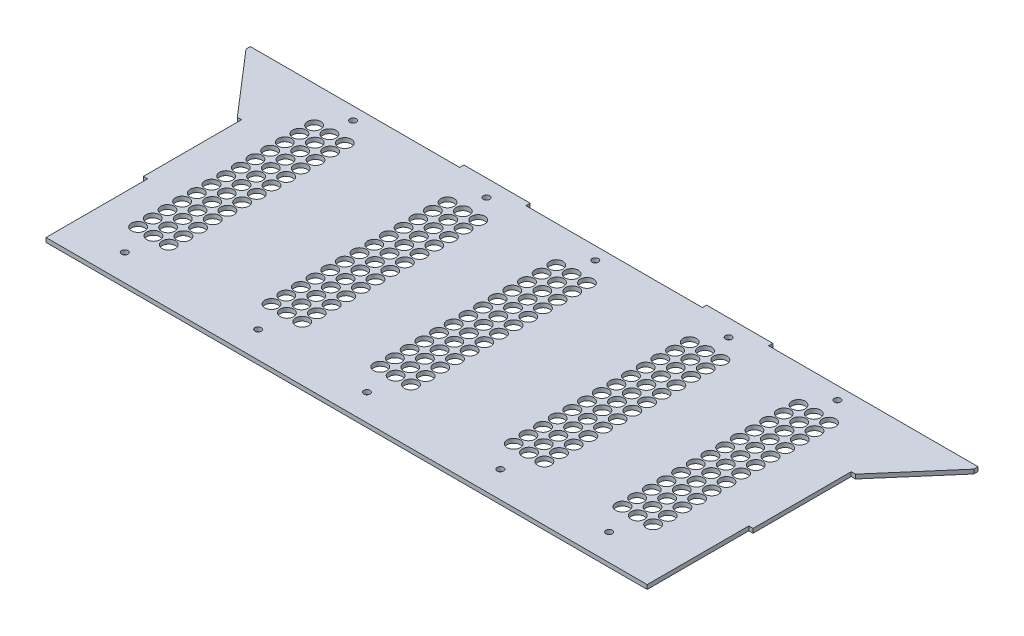
from build123d import *

# Parameters (mm, degrees)
SKETCH1_W                  = 457.2230066
SKETCH1_H                  = 3.175
BOSS_EXTRUDE1_DEPTH        = 200.6419914
BOSS_EXTRUDE3_DEPTH        = 3.175
SKETCH5_W                  = 3.175
SKETCH5_H                  = 76.2
CUT_EXTRUDE2_DEPTH         = 3.175
SKETCH3_W                  = 49.658811606
SKETCH3_H                  = 3.175
BOSS_EXTRUDE4_DEPTH        = 3.18
M4_CLEARANCE_HOLE1_D       = 4.8
LPATTERN5_COUNT            = 3
LPATTERN5_PITCH            = 181.61399999
M4_CLEARANCE_HOLE2_D       = 4.8
LPATTERN6_COUNT            = 2
LPATTERN6_PITCH            = 181.61399999
SKETCH10_R                 = 5
CUT_EXTRUDE3_DEPTH         = 339.72456808
LPATTERN1_COUNT            = 13
LPATTERN1_PITCH            = 11
LPATTERN2_COUNT            = 3
LPATTERN2_PITCH            = 181.61399999
LPATTERN2_COPY_1_SKETCH_R  = 5
LPATTERN2_COPY_1_DEPTH     = 339.72456808
LPATTERN2_COPY_2_SKETCH_R  = 5
LPATTERN2_COPY_2_DEPTH     = 339.72456808
LPATTERN2_COPY_3_SKETCH_R  = 5
LPATTERN2_COPY_3_DEPTH     = 339.72456808
LPATTERN2_COPY_4_SKETCH_R  = 5
LPATTERN2_COPY_4_DEPTH     = 339.72456808
LPATTERN2_COPY_5_SKETCH_R  = 5
LPATTERN2_COPY_5_DEPTH     = 339.72456808
LPATTERN2_COPY_6_SKETCH_R  = 5
LPATTERN2_COPY_6_DEPTH     = 339.72456808
LPATTERN2_COPY_7_SKETCH_R  = 5
LPATTERN2_COPY_7_DEPTH     = 339.72456808
LPATTERN2_COPY_8_SKETCH_R  = 5
LPATTERN2_COPY_8_DEPTH     = 339.72456808
LPATTERN2_COPY_9_SKETCH_R  = 5
LPATTERN2_COPY_9_DEPTH     = 339.72456808
LPATTERN2_COPY_10_SKETCH_R = 5
LPATTERN2_COPY_10_DEPTH    = 339.72456808
LPATTERN2_COPY_11_SKETCH_R = 5
LPATTERN2_COPY_11_DEPTH    = 339.72456808
LPATTERN2_COPY_12_SKETCH_R = 5
LPATTERN2_COPY_12_DEPTH    = 339.72456808
LPATTERN2_COPY_13_SKETCH_R = 5
LPATTERN2_COPY_13_DEPTH    = 339.72456808
LPATTERN2_COPY_14_SKETCH_R = 5
LPATTERN2_COPY_14_DEPTH    = 339.72456808
LPATTERN2_COPY_15_SKETCH_R = 5
LPATTERN2_COPY_15_DEPTH    = 339.72456808
LPATTERN2_COPY_16_SKETCH_R = 5
LPATTERN2_COPY_16_DEPTH    = 339.72456808
LPATTERN2_COPY_17_SKETCH_R = 5
LPATTERN2_COPY_17_DEPTH    = 339.72456808
LPATTERN2_COPY_18_SKETCH_R = 5
LPATTERN2_COPY_18_DEPTH    = 339.72456808
LPATTERN2_COPY_19_SKETCH_R = 5
LPATTERN2_COPY_19_DEPTH    = 339.72456808
LPATTERN2_COPY_20_SKETCH_R = 5
LPATTERN2_COPY_20_DEPTH    = 339.72456808
LPATTERN2_COPY_21_SKETCH_R = 5
LPATTERN2_COPY_21_DEPTH    = 339.72456808
LPATTERN2_COPY_22_SKETCH_R = 5
LPATTERN2_COPY_22_DEPTH    = 339.72456808
LPATTERN2_COPY_23_SKETCH_R = 5
LPATTERN2_COPY_23_DEPTH    = 339.72456808
LPATTERN2_COPY_24_SKETCH_R = 5
LPATTERN2_COPY_24_DEPTH    = 339.72456808
SKETCH11_R                 = 5
CUT_EXTRUDE4_DEPTH         = 339.72456808
LPATTERN3_COUNT            = 13
LPATTERN3_PITCH            = 11
LPATTERN4_COUNT            = 2
LPATTERN4_PITCH            = 181.61399999
LPATTERN4_COPY_1_SKETCH_R  = 5
LPATTERN4_COPY_1_DEPTH     = 339.72456808
LPATTERN4_COPY_2_SKETCH_R  = 5
LPATTERN4_COPY_2_DEPTH     = 339.72456808
LPATTERN4_COPY_3_SKETCH_R  = 5
LPATTERN4_COPY_3_DEPTH     = 339.72456808
LPATTERN4_COPY_4_SKETCH_R  = 5
LPATTERN4_COPY_4_DEPTH     = 339.72456808
LPATTERN4_COPY_5_SKETCH_R  = 5
LPATTERN4_COPY_5_DEPTH     = 339.72456808
LPATTERN4_COPY_6_SKETCH_R  = 5
LPATTERN4_COPY_6_DEPTH     = 339.72456808
LPATTERN4_COPY_7_SKETCH_R  = 5
LPATTERN4_COPY_7_DEPTH     = 339.72456808
LPATTERN4_COPY_8_SKETCH_R  = 5
LPATTERN4_COPY_8_DEPTH     = 339.72456808
LPATTERN4_COPY_9_SKETCH_R  = 5
LPATTERN4_COPY_9_DEPTH     = 339.72456808
LPATTERN4_COPY_10_SKETCH_R = 5
LPATTERN4_COPY_10_DEPTH    = 339.72456808
LPATTERN4_COPY_11_SKETCH_R = 5
LPATTERN4_COPY_11_DEPTH    = 339.72456808
LPATTERN4_COPY_12_SKETCH_R = 5
LPATTERN4_COPY_12_DEPTH    = 339.72456808


with BuildPart() as part:
    # Sketch1 → Boss-Extrude1 (new body)
    with BuildSketch(Plane.XY):
        Rectangle(SKETCH1_W, SKETCH1_H)
    extrude(amount=BOSS_EXTRUDE1_DEPTH)

    # Sketch4 → Boss-Extrude3 (add)
    with BuildSketch(Plane.XZ.offset(1.5875)):
        Polygon((-228.6115033, 0), (-272.8865033, 0), (-272.8865033, 3.175), (-231.7865033, 50.8), (-228.6115033, 50.8), align=None)
    boss_extrude3 = extrude(amount=-BOSS_EXTRUDE3_DEPTH)

    # Mirror1: Boss-Extrude3 across plane
    add(boss_extrude3.mirror(Plane(origin=(0, 0, 0), x_dir=(0, 0, 1), z_dir=(1, 0, 0))))

    # Sketch5 → Cut-Extrude2 (cut)
    with BuildSketch(Plane.XZ.offset(1.5875)):
        with Locations((-227.0240033, 162.5419914)):
            Rectangle(SKETCH5_W, SKETCH5_H)
    cut_extrude2 = extrude(amount=-CUT_EXTRUDE2_DEPTH, mode=Mode.SUBTRACT)

    # Mirror2: Cut-Extrude2 across plane
    add(cut_extrude2.mirror(Plane(origin=(0, 0, 0), x_dir=(0, 0, 1), z_dir=(1, 0, 0))), mode=Mode.SUBTRACT)

    # Sketch3 → Boss-Extrude4 (add)
    with BuildSketch(Plane(origin=(0, 0, 0), x_dir=(-1, 0, 0), z_dir=(0, 0, -1))):
        with Locations((-91.020094169, 0)):
            Rectangle(SKETCH3_W, SKETCH3_H)
        with Locations((91.020094169, 0)):
            Rectangle(SKETCH3_W, SKETCH3_H)
    extrude(amount=BOSS_EXTRUDE4_DEPTH)

    # M4 Clearance Hole1 (through all)
    with Locations(Plane.XZ.offset(1.5875)):
        with Locations((-186.235499988, 9.525), (-186.235499988, 180.775)):
            m4_clearance_hole1 = Hole(M4_CLEARANCE_HOLE1_D / 2)

    # LPattern5: M4 Clearance Hole1 ×3
    with Locations(*[(i * LPATTERN5_PITCH, 0, 0) for i in range(1, LPATTERN5_COUNT)]):
        add(m4_clearance_hole1, mode=Mode.SUBTRACT)

    # M4 Clearance Hole2 (through all)
    with Locations(Plane.XZ.offset(1.5875)):
        with Locations((-86.190499988, 9.525), (-86.190499988, 180.775)):
            m4_clearance_hole2 = Hole(M4_CLEARANCE_HOLE2_D / 2)

    # LPattern6: M4 Clearance Hole2 ×2
    with Locations(*[(i * LPATTERN6_PITCH, 0, 0) for i in range(1, LPATTERN6_COUNT)]):
        add(m4_clearance_hole2, mode=Mode.SUBTRACT)

    # Sketch10 → Cut-Extrude3 (cut, through all)
    with BuildSketch(Plane.XZ.offset(1.5875)):
        with Locations(Location((-197.735499988, 159.256662939, 0), (0, 0, 270))):
            Circle(SKETCH10_R)
        with Locations(Location((-186.235499988, 159.256662939, 0), (0, 0, 270))):
            Circle(SKETCH10_R)
        with Locations(Location((-174.735499988, 159.256662939, 0), (0, 0, 270))):
            Circle(SKETCH10_R)
    cut_extrude3 = extrude(amount=-CUT_EXTRUDE3_DEPTH, mode=Mode.SUBTRACT)

    # LPattern1: Cut-Extrude3 ×13
    with Locations(*[(0, 0, -i * LPATTERN1_PITCH) for i in range(1, LPATTERN1_COUNT)]):
        add(cut_extrude3, mode=Mode.SUBTRACT)

    # LPattern2: Cut-Extrude3 ×3
    with Locations(*[(i * LPATTERN2_PITCH, 0, 0) for i in range(1, LPATTERN2_COUNT)]):
        add(cut_extrude3, mode=Mode.SUBTRACT)

    # LPattern2 copy 1 sketch → LPattern2 copy 1 (cut, through all)
    with BuildSketch(Plane(origin=(181.61399999, -1.5875, -11), x_dir=(1, 0, 0), z_dir=(0, -1, 0))):
        with Locations(Location((-197.735499988, 159.256662939, 0), (0, 0, 270))):
            Circle(LPATTERN2_COPY_1_SKETCH_R)
        with Locations(Location((-186.235499988, 159.256662939, 0), (0, 0, 270))):
            Circle(LPATTERN2_COPY_1_SKETCH_R)
        with Locations(Location((-174.735499988, 159.256662939, 0), (0, 0, 270))):
            Circle(LPATTERN2_COPY_1_SKETCH_R)
    extrude(amount=-LPATTERN2_COPY_1_DEPTH, mode=Mode.SUBTRACT)

    # LPattern2 copy 2 sketch → LPattern2 copy 2 (cut, through all)
    with BuildSketch(Plane(origin=(363.22799998, -1.5875, -11), x_dir=(1, 0, 0), z_dir=(0, -1, 0))):
        with Locations(Location((-197.735499988, 159.256662939, 0), (0, 0, 270))):
            Circle(LPATTERN2_COPY_2_SKETCH_R)
        with Locations(Location((-186.235499988, 159.256662939, 0), (0, 0, 270))):
            Circle(LPATTERN2_COPY_2_SKETCH_R)
        with Locations(Location((-174.735499988, 159.256662939, 0), (0, 0, 270))):
            Circle(LPATTERN2_COPY_2_SKETCH_R)
    extrude(amount=-LPATTERN2_COPY_2_DEPTH, mode=Mode.SUBTRACT)

    # LPattern2 copy 3 sketch → LPattern2 copy 3 (cut, through all)
    with BuildSketch(Plane(origin=(181.61399999, -1.5875, -22), x_dir=(1, 0, 0), z_dir=(0, -1, 0))):
        with Locations(Location((-197.735499988, 159.256662939, 0), (0, 0, 270))):
            Circle(LPATTERN2_COPY_3_SKETCH_R)
        with Locations(Location((-186.235499988, 159.256662939, 0), (0, 0, 270))):
            Circle(LPATTERN2_COPY_3_SKETCH_R)
        with Locations(Location((-174.735499988, 159.256662939, 0), (0, 0, 270))):
            Circle(LPATTERN2_COPY_3_SKETCH_R)
    extrude(amount=-LPATTERN2_COPY_3_DEPTH, mode=Mode.SUBTRACT)

    # LPattern2 copy 4 sketch → LPattern2 copy 4 (cut, through all)
    with BuildSketch(Plane(origin=(363.22799998, -1.5875, -22), x_dir=(1, 0, 0), z_dir=(0, -1, 0))):
        with Locations(Location((-197.735499988, 159.256662939, 0), (0, 0, 270))):
            Circle(LPATTERN2_COPY_4_SKETCH_R)
        with Locations(Location((-186.235499988, 159.256662939, 0), (0, 0, 270))):
            Circle(LPATTERN2_COPY_4_SKETCH_R)
        with Locations(Location((-174.735499988, 159.256662939, 0), (0, 0, 270))):
            Circle(LPATTERN2_COPY_4_SKETCH_R)
    extrude(amount=-LPATTERN2_COPY_4_DEPTH, mode=Mode.SUBTRACT)

    # LPattern2 copy 5 sketch → LPattern2 copy 5 (cut, through all)
    with BuildSketch(Plane(origin=(181.61399999, -1.5875, -33), x_dir=(1, 0, 0), z_dir=(0, -1, 0))):
        with Locations(Location((-197.735499988, 159.256662939, 0), (0, 0, 270))):
            Circle(LPATTERN2_COPY_5_SKETCH_R)
        with Locations(Location((-186.235499988, 159.256662939, 0), (0, 0, 270))):
            Circle(LPATTERN2_COPY_5_SKETCH_R)
        with Locations(Location((-174.735499988, 159.256662939, 0), (0, 0, 270))):
            Circle(LPATTERN2_COPY_5_SKETCH_R)
    extrude(amount=-LPATTERN2_COPY_5_DEPTH, mode=Mode.SUBTRACT)

    # LPattern2 copy 6 sketch → LPattern2 copy 6 (cut, through all)
    with BuildSketch(Plane(origin=(363.22799998, -1.5875, -33), x_dir=(1, 0, 0), z_dir=(0, -1, 0))):
        with Locations(Location((-197.735499988, 159.256662939, 0), (0, 0, 270))):
            Circle(LPATTERN2_COPY_6_SKETCH_R)
        with Locations(Location((-186.235499988, 159.256662939, 0), (0, 0, 270))):
            Circle(LPATTERN2_COPY_6_SKETCH_R)
        with Locations(Location((-174.735499988, 159.256662939, 0), (0, 0, 270))):
            Circle(LPATTERN2_COPY_6_SKETCH_R)
    extrude(amount=-LPATTERN2_COPY_6_DEPTH, mode=Mode.SUBTRACT)

    # LPattern2 copy 7 sketch → LPattern2 copy 7 (cut, through all)
    with BuildSketch(Plane(origin=(181.61399999, -1.5875, -44), x_dir=(1, 0, 0), z_dir=(0, -1, 0))):
        with Locations(Location((-197.735499988, 159.256662939, 0), (0, 0, 270))):
            Circle(LPATTERN2_COPY_7_SKETCH_R)
        with Locations(Location((-186.235499988, 159.256662939, 0), (0, 0, 270))):
            Circle(LPATTERN2_COPY_7_SKETCH_R)
        with Locations(Location((-174.735499988, 159.256662939, 0), (0, 0, 270))):
            Circle(LPATTERN2_COPY_7_SKETCH_R)
    extrude(amount=-LPATTERN2_COPY_7_DEPTH, mode=Mode.SUBTRACT)

    # LPattern2 copy 8 sketch → LPattern2 copy 8 (cut, through all)
    with BuildSketch(Plane(origin=(363.22799998, -1.5875, -44), x_dir=(1, 0, 0), z_dir=(0, -1, 0))):
        with Locations(Location((-197.735499988, 159.256662939, 0), (0, 0, 270))):
            Circle(LPATTERN2_COPY_8_SKETCH_R)
        with Locations(Location((-186.235499988, 159.256662939, 0), (0, 0, 270))):
            Circle(LPATTERN2_COPY_8_SKETCH_R)
        with Locations(Location((-174.735499988, 159.256662939, 0), (0, 0, 270))):
            Circle(LPATTERN2_COPY_8_SKETCH_R)
    extrude(amount=-LPATTERN2_COPY_8_DEPTH, mode=Mode.SUBTRACT)

    # LPattern2 copy 9 sketch → LPattern2 copy 9 (cut, through all)
    with BuildSketch(Plane(origin=(181.61399999, -1.5875, -55), x_dir=(1, 0, 0), z_dir=(0, -1, 0))):
        with Locations(Location((-197.735499988, 159.256662939, 0), (0, 0, 270))):
            Circle(LPATTERN2_COPY_9_SKETCH_R)
        with Locations(Location((-186.235499988, 159.256662939, 0), (0, 0, 270))):
            Circle(LPATTERN2_COPY_9_SKETCH_R)
        with Locations(Location((-174.735499988, 159.256662939, 0), (0, 0, 270))):
            Circle(LPATTERN2_COPY_9_SKETCH_R)
    extrude(amount=-LPATTERN2_COPY_9_DEPTH, mode=Mode.SUBTRACT)

    # LPattern2 copy 10 sketch → LPattern2 copy 10 (cut, through all)
    with BuildSketch(Plane(origin=(363.22799998, -1.5875, -55), x_dir=(1, 0, 0), z_dir=(0, -1, 0))):
        with Locations(Location((-197.735499988, 159.256662939, 0), (0, 0, 270))):
            Circle(LPATTERN2_COPY_10_SKETCH_R)
        with Locations(Location((-186.235499988, 159.256662939, 0), (0, 0, 270))):
            Circle(LPATTERN2_COPY_10_SKETCH_R)
        with Locations(Location((-174.735499988, 159.256662939, 0), (0, 0, 270))):
            Circle(LPATTERN2_COPY_10_SKETCH_R)
    extrude(amount=-LPATTERN2_COPY_10_DEPTH, mode=Mode.SUBTRACT)

    # LPattern2 copy 11 sketch → LPattern2 copy 11 (cut, through all)
    with BuildSketch(Plane(origin=(181.61399999, -1.5875, -66), x_dir=(1, 0, 0), z_dir=(0, -1, 0))):
        with Locations(Location((-197.735499988, 159.256662939, 0), (0, 0, 270))):
            Circle(LPATTERN2_COPY_11_SKETCH_R)
        with Locations(Location((-186.235499988, 159.256662939, 0), (0, 0, 270))):
            Circle(LPATTERN2_COPY_11_SKETCH_R)
        with Locations(Location((-174.735499988, 159.256662939, 0), (0, 0, 270))):
            Circle(LPATTERN2_COPY_11_SKETCH_R)
    extrude(amount=-LPATTERN2_COPY_11_DEPTH, mode=Mode.SUBTRACT)

    # LPattern2 copy 12 sketch → LPattern2 copy 12 (cut, through all)
    with BuildSketch(Plane(origin=(363.22799998, -1.5875, -66), x_dir=(1, 0, 0), z_dir=(0, -1, 0))):
        with Locations(Location((-197.735499988, 159.256662939, 0), (0, 0, 270))):
            Circle(LPATTERN2_COPY_12_SKETCH_R)
        with Locations(Location((-186.235499988, 159.256662939, 0), (0, 0, 270))):
            Circle(LPATTERN2_COPY_12_SKETCH_R)
        with Locations(Location((-174.735499988, 159.256662939, 0), (0, 0, 270))):
            Circle(LPATTERN2_COPY_12_SKETCH_R)
    extrude(amount=-LPATTERN2_COPY_12_DEPTH, mode=Mode.SUBTRACT)

    # LPattern2 copy 13 sketch → LPattern2 copy 13 (cut, through all)
    with BuildSketch(Plane(origin=(181.61399999, -1.5875, -77), x_dir=(1, 0, 0), z_dir=(0, -1, 0))):
        with Locations(Location((-197.735499988, 159.256662939, 0), (0, 0, 270))):
            Circle(LPATTERN2_COPY_13_SKETCH_R)
        with Locations(Location((-186.235499988, 159.256662939, 0), (0, 0, 270))):
            Circle(LPATTERN2_COPY_13_SKETCH_R)
        with Locations(Location((-174.735499988, 159.256662939, 0), (0, 0, 270))):
            Circle(LPATTERN2_COPY_13_SKETCH_R)
    extrude(amount=-LPATTERN2_COPY_13_DEPTH, mode=Mode.SUBTRACT)

    # LPattern2 copy 14 sketch → LPattern2 copy 14 (cut, through all)
    with BuildSketch(Plane(origin=(363.22799998, -1.5875, -77), x_dir=(1, 0, 0), z_dir=(0, -1, 0))):
        with Locations(Location((-197.735499988, 159.256662939, 0), (0, 0, 270))):
            Circle(LPATTERN2_COPY_14_SKETCH_R)
        with Locations(Location((-186.235499988, 159.256662939, 0), (0, 0, 270))):
            Circle(LPATTERN2_COPY_14_SKETCH_R)
        with Locations(Location((-174.735499988, 159.256662939, 0), (0, 0, 270))):
            Circle(LPATTERN2_COPY_14_SKETCH_R)
    extrude(amount=-LPATTERN2_COPY_14_DEPTH, mode=Mode.SUBTRACT)

    # LPattern2 copy 15 sketch → LPattern2 copy 15 (cut, through all)
    with BuildSketch(Plane(origin=(181.61399999, -1.5875, -88), x_dir=(1, 0, 0), z_dir=(0, -1, 0))):
        with Locations(Location((-197.735499988, 159.256662939, 0), (0, 0, 270))):
            Circle(LPATTERN2_COPY_15_SKETCH_R)
        with Locations(Location((-186.235499988, 159.256662939, 0), (0, 0, 270))):
            Circle(LPATTERN2_COPY_15_SKETCH_R)
        with Locations(Location((-174.735499988, 159.256662939, 0), (0, 0, 270))):
            Circle(LPATTERN2_COPY_15_SKETCH_R)
    extrude(amount=-LPATTERN2_COPY_15_DEPTH, mode=Mode.SUBTRACT)

    # LPattern2 copy 16 sketch → LPattern2 copy 16 (cut, through all)
    with BuildSketch(Plane(origin=(363.22799998, -1.5875, -88), x_dir=(1, 0, 0), z_dir=(0, -1, 0))):
        with Locations(Location((-197.735499988, 159.256662939, 0), (0, 0, 270))):
            Circle(LPATTERN2_COPY_16_SKETCH_R)
        with Locations(Location((-186.235499988, 159.256662939, 0), (0, 0, 270))):
            Circle(LPATTERN2_COPY_16_SKETCH_R)
        with Locations(Location((-174.735499988, 159.256662939, 0), (0, 0, 270))):
            Circle(LPATTERN2_COPY_16_SKETCH_R)
    extrude(amount=-LPATTERN2_COPY_16_DEPTH, mode=Mode.SUBTRACT)

    # LPattern2 copy 17 sketch → LPattern2 copy 17 (cut, through all)
    with BuildSketch(Plane(origin=(181.61399999, -1.5875, -99), x_dir=(1, 0, 0), z_dir=(0, -1, 0))):
        with Locations(Location((-197.735499988, 159.256662939, 0), (0, 0, 270))):
            Circle(LPATTERN2_COPY_17_SKETCH_R)
        with Locations(Location((-186.235499988, 159.256662939, 0), (0, 0, 270))):
            Circle(LPATTERN2_COPY_17_SKETCH_R)
        with Locations(Location((-174.735499988, 159.256662939, 0), (0, 0, 270))):
            Circle(LPATTERN2_COPY_17_SKETCH_R)
    extrude(amount=-LPATTERN2_COPY_17_DEPTH, mode=Mode.SUBTRACT)

    # LPattern2 copy 18 sketch → LPattern2 copy 18 (cut, through all)
    with BuildSketch(Plane(origin=(363.22799998, -1.5875, -99), x_dir=(1, 0, 0), z_dir=(0, -1, 0))):
        with Locations(Location((-197.735499988, 159.256662939, 0), (0, 0, 270))):
            Circle(LPATTERN2_COPY_18_SKETCH_R)
        with Locations(Location((-186.235499988, 159.256662939, 0), (0, 0, 270))):
            Circle(LPATTERN2_COPY_18_SKETCH_R)
        with Locations(Location((-174.735499988, 159.256662939, 0), (0, 0, 270))):
            Circle(LPATTERN2_COPY_18_SKETCH_R)
    extrude(amount=-LPATTERN2_COPY_18_DEPTH, mode=Mode.SUBTRACT)

    # LPattern2 copy 19 sketch → LPattern2 copy 19 (cut, through all)
    with BuildSketch(Plane(origin=(181.61399999, -1.5875, -110), x_dir=(1, 0, 0), z_dir=(0, -1, 0))):
        with Locations(Location((-197.735499988, 159.256662939, 0), (0, 0, 270))):
            Circle(LPATTERN2_COPY_19_SKETCH_R)
        with Locations(Location((-186.235499988, 159.256662939, 0), (0, 0, 270))):
            Circle(LPATTERN2_COPY_19_SKETCH_R)
        with Locations(Location((-174.735499988, 159.256662939, 0), (0, 0, 270))):
            Circle(LPATTERN2_COPY_19_SKETCH_R)
    extrude(amount=-LPATTERN2_COPY_19_DEPTH, mode=Mode.SUBTRACT)

    # LPattern2 copy 20 sketch → LPattern2 copy 20 (cut, through all)
    with BuildSketch(Plane(origin=(363.22799998, -1.5875, -110), x_dir=(1, 0, 0), z_dir=(0, -1, 0))):
        with Locations(Location((-197.735499988, 159.256662939, 0), (0, 0, 270))):
            Circle(LPATTERN2_COPY_20_SKETCH_R)
        with Locations(Location((-186.235499988, 159.256662939, 0), (0, 0, 270))):
            Circle(LPATTERN2_COPY_20_SKETCH_R)
        with Locations(Location((-174.735499988, 159.256662939, 0), (0, 0, 270))):
            Circle(LPATTERN2_COPY_20_SKETCH_R)
    extrude(amount=-LPATTERN2_COPY_20_DEPTH, mode=Mode.SUBTRACT)

    # LPattern2 copy 21 sketch → LPattern2 copy 21 (cut, through all)
    with BuildSketch(Plane(origin=(181.61399999, -1.5875, -121), x_dir=(1, 0, 0), z_dir=(0, -1, 0))):
        with Locations(Location((-197.735499988, 159.256662939, 0), (0, 0, 270))):
            Circle(LPATTERN2_COPY_21_SKETCH_R)
        with Locations(Location((-186.235499988, 159.256662939, 0), (0, 0, 270))):
            Circle(LPATTERN2_COPY_21_SKETCH_R)
        with Locations(Location((-174.735499988, 159.256662939, 0), (0, 0, 270))):
            Circle(LPATTERN2_COPY_21_SKETCH_R)
    extrude(amount=-LPATTERN2_COPY_21_DEPTH, mode=Mode.SUBTRACT)

    # LPattern2 copy 22 sketch → LPattern2 copy 22 (cut, through all)
    with BuildSketch(Plane(origin=(363.22799998, -1.5875, -121), x_dir=(1, 0, 0), z_dir=(0, -1, 0))):
        with Locations(Location((-197.735499988, 159.256662939, 0), (0, 0, 270))):
            Circle(LPATTERN2_COPY_22_SKETCH_R)
        with Locations(Location((-186.235499988, 159.256662939, 0), (0, 0, 270))):
            Circle(LPATTERN2_COPY_22_SKETCH_R)
        with Locations(Location((-174.735499988, 159.256662939, 0), (0, 0, 270))):
            Circle(LPATTERN2_COPY_22_SKETCH_R)
    extrude(amount=-LPATTERN2_COPY_22_DEPTH, mode=Mode.SUBTRACT)

    # LPattern2 copy 23 sketch → LPattern2 copy 23 (cut, through all)
    with BuildSketch(Plane(origin=(181.61399999, -1.5875, -132), x_dir=(1, 0, 0), z_dir=(0, -1, 0))):
        with Locations(Location((-197.735499988, 159.256662939, 0), (0, 0, 270))):
            Circle(LPATTERN2_COPY_23_SKETCH_R)
        with Locations(Location((-186.235499988, 159.256662939, 0), (0, 0, 270))):
            Circle(LPATTERN2_COPY_23_SKETCH_R)
        with Locations(Location((-174.735499988, 159.256662939, 0), (0, 0, 270))):
            Circle(LPATTERN2_COPY_23_SKETCH_R)
    extrude(amount=-LPATTERN2_COPY_23_DEPTH, mode=Mode.SUBTRACT)

    # LPattern2 copy 24 sketch → LPattern2 copy 24 (cut, through all)
    with BuildSketch(Plane(origin=(363.22799998, -1.5875, -132), x_dir=(1, 0, 0), z_dir=(0, -1, 0))):
        with Locations(Location((-197.735499988, 159.256662939, 0), (0, 0, 270))):
            Circle(LPATTERN2_COPY_24_SKETCH_R)
        with Locations(Location((-186.235499988, 159.256662939, 0), (0, 0, 270))):
            Circle(LPATTERN2_COPY_24_SKETCH_R)
        with Locations(Location((-174.735499988, 159.256662939, 0), (0, 0, 270))):
            Circle(LPATTERN2_COPY_24_SKETCH_R)
    extrude(amount=-LPATTERN2_COPY_24_DEPTH, mode=Mode.SUBTRACT)

    # Sketch11 → Cut-Extrude4 (cut, through all)
    with BuildSketch(Plane.XZ.offset(1.5875)):
        with Locations(Location((-97.690499988, 159.256662939, 0), (0, 0, 270))):
            Circle(SKETCH11_R)
        with Locations(Location((-86.190499988, 159.256662939, 0), (0, 0, 270))):
            Circle(SKETCH11_R)
        with Locations(Location((-74.690499988, 159.256662939, 0), (0, 0, 270))):
            Circle(SKETCH11_R)
    cut_extrude4 = extrude(amount=-CUT_EXTRUDE4_DEPTH, mode=Mode.SUBTRACT)

    # LPattern3: Cut-Extrude4 ×13
    with Locations(*[(0, 0, -i * LPATTERN3_PITCH) for i in range(1, LPATTERN3_COUNT)]):
        add(cut_extrude4, mode=Mode.SUBTRACT)

    # LPattern4: Cut-Extrude4 ×2
    with Locations(*[(i * LPATTERN4_PITCH, 0, 0) for i in range(1, LPATTERN4_COUNT)]):
        add(cut_extrude4, mode=Mode.SUBTRACT)

    # LPattern4 copy 1 sketch → LPattern4 copy 1 (cut, through all)
    with BuildSketch(Plane(origin=(181.61399999, -1.5875, -11), x_dir=(1, 0, 0), z_dir=(0, -1, 0))):
        with Locations(Location((-97.690499988, 159.256662939, 0), (0, 0, 270))):
            Circle(LPATTERN4_COPY_1_SKETCH_R)
        with Locations(Location((-86.190499988, 159.256662939, 0), (0, 0, 270))):
            Circle(LPATTERN4_COPY_1_SKETCH_R)
        with Locations(Location((-74.690499988, 159.256662939, 0), (0, 0, 270))):
            Circle(LPATTERN4_COPY_1_SKETCH_R)
    extrude(amount=-LPATTERN4_COPY_1_DEPTH, mode=Mode.SUBTRACT)

    # LPattern4 copy 2 sketch → LPattern4 copy 2 (cut, through all)
    with BuildSketch(Plane(origin=(181.61399999, -1.5875, -22), x_dir=(1, 0, 0), z_dir=(0, -1, 0))):
        with Locations(Location((-97.690499988, 159.256662939, 0), (0, 0, 270))):
            Circle(LPATTERN4_COPY_2_SKETCH_R)
        with Locations(Location((-86.190499988, 159.256662939, 0), (0, 0, 270))):
            Circle(LPATTERN4_COPY_2_SKETCH_R)
        with Locations(Location((-74.690499988, 159.256662939, 0), (0, 0, 270))):
            Circle(LPATTERN4_COPY_2_SKETCH_R)
    extrude(amount=-LPATTERN4_COPY_2_DEPTH, mode=Mode.SUBTRACT)

    # LPattern4 copy 3 sketch → LPattern4 copy 3 (cut, through all)
    with BuildSketch(Plane(origin=(181.61399999, -1.5875, -33), x_dir=(1, 0, 0), z_dir=(0, -1, 0))):
        with Locations(Location((-97.690499988, 159.256662939, 0), (0, 0, 270))):
            Circle(LPATTERN4_COPY_3_SKETCH_R)
        with Locations(Location((-86.190499988, 159.256662939, 0), (0, 0, 270))):
            Circle(LPATTERN4_COPY_3_SKETCH_R)
        with Locations(Location((-74.690499988, 159.256662939, 0), (0, 0, 270))):
            Circle(LPATTERN4_COPY_3_SKETCH_R)
    extrude(amount=-LPATTERN4_COPY_3_DEPTH, mode=Mode.SUBTRACT)

    # LPattern4 copy 4 sketch → LPattern4 copy 4 (cut, through all)
    with BuildSketch(Plane(origin=(181.61399999, -1.5875, -44), x_dir=(1, 0, 0), z_dir=(0, -1, 0))):
        with Locations(Location((-97.690499988, 159.256662939, 0), (0, 0, 270))):
            Circle(LPATTERN4_COPY_4_SKETCH_R)
        with Locations(Location((-86.190499988, 159.256662939, 0), (0, 0, 270))):
            Circle(LPATTERN4_COPY_4_SKETCH_R)
        with Locations(Location((-74.690499988, 159.256662939, 0), (0, 0, 270))):
            Circle(LPATTERN4_COPY_4_SKETCH_R)
    extrude(amount=-LPATTERN4_COPY_4_DEPTH, mode=Mode.SUBTRACT)

    # LPattern4 copy 5 sketch → LPattern4 copy 5 (cut, through all)
    with BuildSketch(Plane(origin=(181.61399999, -1.5875, -55), x_dir=(1, 0, 0), z_dir=(0, -1, 0))):
        with Locations(Location((-97.690499988, 159.256662939, 0), (0, 0, 270))):
            Circle(LPATTERN4_COPY_5_SKETCH_R)
        with Locations(Location((-86.190499988, 159.256662939, 0), (0, 0, 270))):
            Circle(LPATTERN4_COPY_5_SKETCH_R)
        with Locations(Location((-74.690499988, 159.256662939, 0), (0, 0, 270))):
            Circle(LPATTERN4_COPY_5_SKETCH_R)
    extrude(amount=-LPATTERN4_COPY_5_DEPTH, mode=Mode.SUBTRACT)

    # LPattern4 copy 6 sketch → LPattern4 copy 6 (cut, through all)
    with BuildSketch(Plane(origin=(181.61399999, -1.5875, -66), x_dir=(1, 0, 0), z_dir=(0, -1, 0))):
        with Locations(Location((-97.690499988, 159.256662939, 0), (0, 0, 270))):
            Circle(LPATTERN4_COPY_6_SKETCH_R)
        with Locations(Location((-86.190499988, 159.256662939, 0), (0, 0, 270))):
            Circle(LPATTERN4_COPY_6_SKETCH_R)
        with Locations(Location((-74.690499988, 159.256662939, 0), (0, 0, 270))):
            Circle(LPATTERN4_COPY_6_SKETCH_R)
    extrude(amount=-LPATTERN4_COPY_6_DEPTH, mode=Mode.SUBTRACT)

    # LPattern4 copy 7 sketch → LPattern4 copy 7 (cut, through all)
    with BuildSketch(Plane(origin=(181.61399999, -1.5875, -77), x_dir=(1, 0, 0), z_dir=(0, -1, 0))):
        with Locations(Location((-97.690499988, 159.256662939, 0), (0, 0, 270))):
            Circle(LPATTERN4_COPY_7_SKETCH_R)
        with Locations(Location((-86.190499988, 159.256662939, 0), (0, 0, 270))):
            Circle(LPATTERN4_COPY_7_SKETCH_R)
        with Locations(Location((-74.690499988, 159.256662939, 0), (0, 0, 270))):
            Circle(LPATTERN4_COPY_7_SKETCH_R)
    extrude(amount=-LPATTERN4_COPY_7_DEPTH, mode=Mode.SUBTRACT)

    # LPattern4 copy 8 sketch → LPattern4 copy 8 (cut, through all)
    with BuildSketch(Plane(origin=(181.61399999, -1.5875, -88), x_dir=(1, 0, 0), z_dir=(0, -1, 0))):
        with Locations(Location((-97.690499988, 159.256662939, 0), (0, 0, 270))):
            Circle(LPATTERN4_COPY_8_SKETCH_R)
        with Locations(Location((-86.190499988, 159.256662939, 0), (0, 0, 270))):
            Circle(LPATTERN4_COPY_8_SKETCH_R)
        with Locations(Location((-74.690499988, 159.256662939, 0), (0, 0, 270))):
            Circle(LPATTERN4_COPY_8_SKETCH_R)
    extrude(amount=-LPATTERN4_COPY_8_DEPTH, mode=Mode.SUBTRACT)

    # LPattern4 copy 9 sketch → LPattern4 copy 9 (cut, through all)
    with BuildSketch(Plane(origin=(181.61399999, -1.5875, -99), x_dir=(1, 0, 0), z_dir=(0, -1, 0))):
        with Locations(Location((-97.690499988, 159.256662939, 0), (0, 0, 270))):
            Circle(LPATTERN4_COPY_9_SKETCH_R)
        with Locations(Location((-86.190499988, 159.256662939, 0), (0, 0, 270))):
            Circle(LPATTERN4_COPY_9_SKETCH_R)
        with Locations(Location((-74.690499988, 159.256662939, 0), (0, 0, 270))):
            Circle(LPATTERN4_COPY_9_SKETCH_R)
    extrude(amount=-LPATTERN4_COPY_9_DEPTH, mode=Mode.SUBTRACT)

    # LPattern4 copy 10 sketch → LPattern4 copy 10 (cut, through all)
    with BuildSketch(Plane(origin=(181.61399999, -1.5875, -110), x_dir=(1, 0, 0), z_dir=(0, -1, 0))):
        with Locations(Location((-97.690499988, 159.256662939, 0), (0, 0, 270))):
            Circle(LPATTERN4_COPY_10_SKETCH_R)
        with Locations(Location((-86.190499988, 159.256662939, 0), (0, 0, 270))):
            Circle(LPATTERN4_COPY_10_SKETCH_R)
        with Locations(Location((-74.690499988, 159.256662939, 0), (0, 0, 270))):
            Circle(LPATTERN4_COPY_10_SKETCH_R)
    extrude(amount=-LPATTERN4_COPY_10_DEPTH, mode=Mode.SUBTRACT)

    # LPattern4 copy 11 sketch → LPattern4 copy 11 (cut, through all)
    with BuildSketch(Plane(origin=(181.61399999, -1.5875, -121), x_dir=(1, 0, 0), z_dir=(0, -1, 0))):
        with Locations(Location((-97.690499988, 159.256662939, 0), (0, 0, 270))):
            Circle(LPATTERN4_COPY_11_SKETCH_R)
        with Locations(Location((-86.190499988, 159.256662939, 0), (0, 0, 270))):
            Circle(LPATTERN4_COPY_11_SKETCH_R)
        with Locations(Location((-74.690499988, 159.256662939, 0), (0, 0, 270))):
            Circle(LPATTERN4_COPY_11_SKETCH_R)
    extrude(amount=-LPATTERN4_COPY_11_DEPTH, mode=Mode.SUBTRACT)

    # LPattern4 copy 12 sketch → LPattern4 copy 12 (cut, through all)
    with BuildSketch(Plane(origin=(181.61399999, -1.5875, -132), x_dir=(1, 0, 0), z_dir=(0, -1, 0))):
        with Locations(Location((-97.690499988, 159.256662939, 0), (0, 0, 270))):
            Circle(LPATTERN4_COPY_12_SKETCH_R)
        with Locations(Location((-86.190499988, 159.256662939, 0), (0, 0, 270))):
            Circle(LPATTERN4_COPY_12_SKETCH_R)
        with Locations(Location((-74.690499988, 159.256662939, 0), (0, 0, 270))):
            Circle(LPATTERN4_COPY_12_SKETCH_R)
    extrude(amount=-LPATTERN4_COPY_12_DEPTH, mode=Mode.SUBTRACT)


solid = part.part
